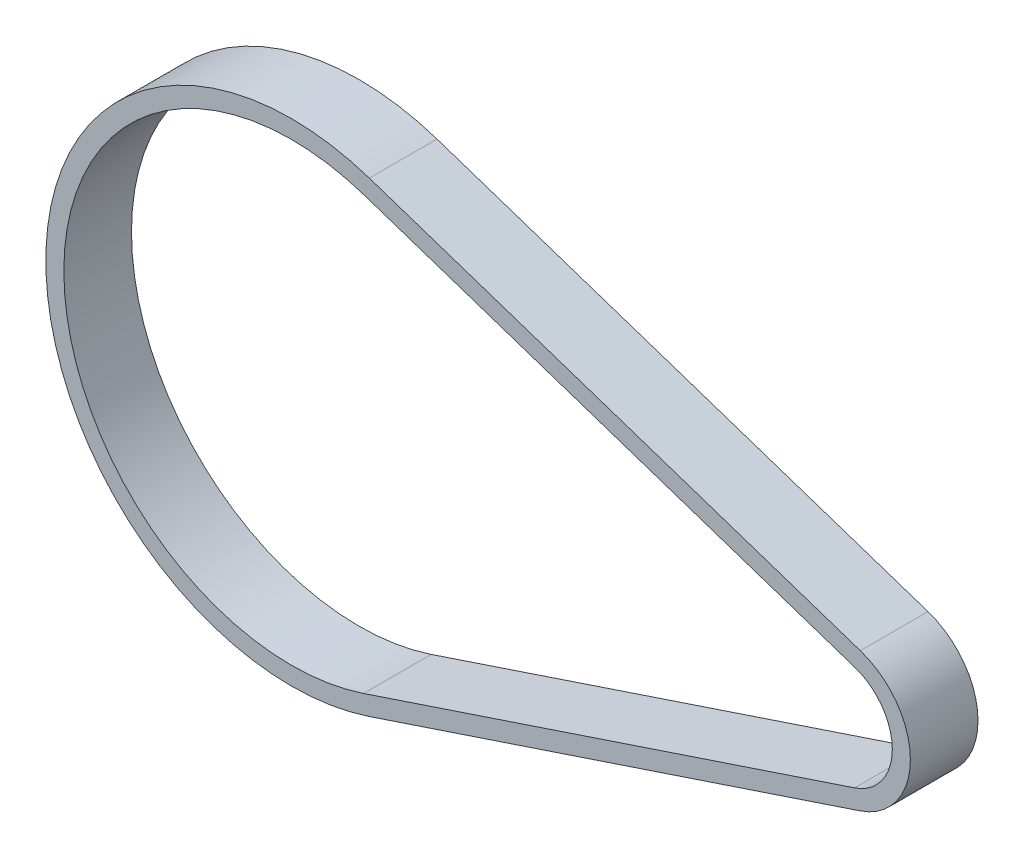
from build123d import *

# Parameters (mm, degrees)
BOSS_EXTRUDE1_DEPTH = 7.5


with BuildPart() as part:
    # Sketch1 → Boss-Extrude1 (new body)
    with BuildSketch(Plane.XY):
        with BuildLine():
            Line((-14.129090909, 25.850385422), (40.315709091, 7.693454157))
            ThreePointArc((40.315709091, 7.693454157), (45.86, 0), (40.315709091, -7.693454157))
            Line((40.315709091, -7.693454157), (-14.129090909, -25.850385422))
            ThreePointArc((-14.129090909, -25.850385422), (-50, 0), (-14.129090909, 25.850385422))
        make_face()
        with BuildLine():
            Line((39.682981818, 5.796178162), (-14.761818182, 23.953109427))
            ThreePointArc((-14.761818182, 23.953109427), (-48, 0), (-14.761818182, -23.953109427))
            Line((-14.761818182, -23.953109427), (39.682981818, -5.796178162))
            ThreePointArc((39.682981818, -5.796178162), (43.86, 0), (39.682981818, 5.796178162))
        make_face(mode=Mode.SUBTRACT)
    extrude(amount=BOSS_EXTRUDE1_DEPTH)


solid = part.part
